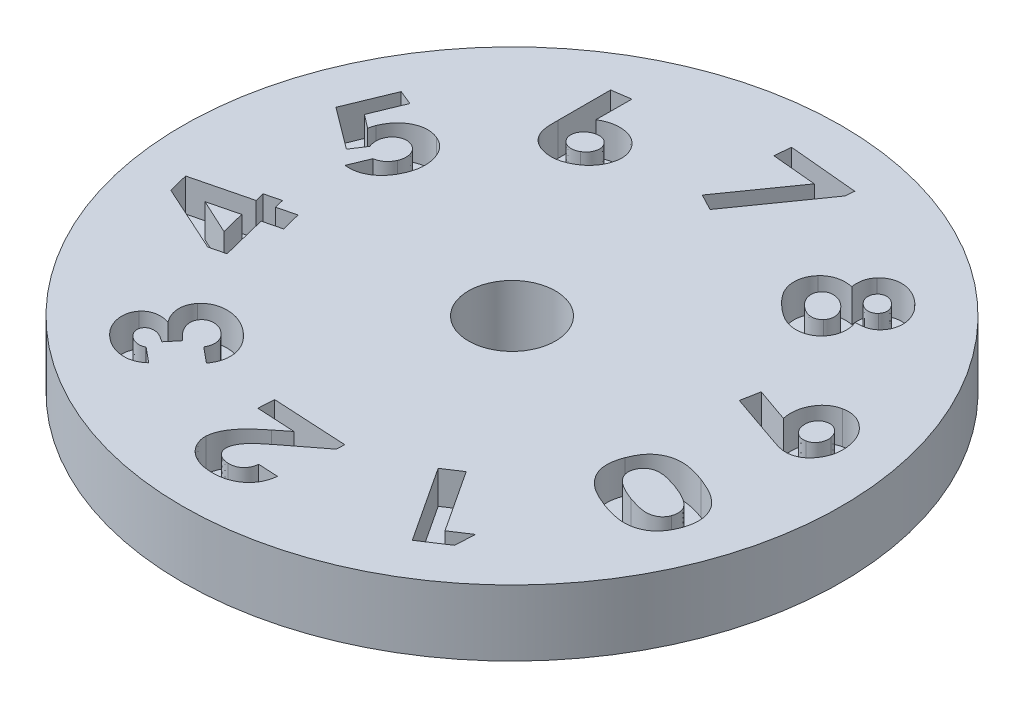
from build123d import *

# Parameters (mm, degrees)
SKETCH1_R           = 12.7
BOSS_EXTRUDE1_DEPTH = 2.54
SKETCH2_R           = 1.6764
CUT_EXTRUDE1_DEPTH  = 2.54
CUT_EXTRUDE4_DEPTH  = 1.27


with BuildPart() as part:
    # Sketch1 → Boss-Extrude1 (new body)
    with BuildSketch(Plane(origin=(0, 0, 0), x_dir=(1, 0, 0), z_dir=(0, 1, 0))):
        with Locations(Location((0, 0, 0), (0, 0, 270))):
            Circle(SKETCH1_R)
    extrude(amount=BOSS_EXTRUDE1_DEPTH)

    # Sketch2 → Cut-Extrude1 (cut)
    with BuildSketch(Plane(origin=(0, 2.54, 0), x_dir=(1, 0, 0), z_dir=(0, 1, 0))):
        with Locations(Location((0, 0, 0), (0, 0, 270))):
            Circle(SKETCH2_R)
    extrude(amount=-CUT_EXTRUDE1_DEPTH, mode=Mode.SUBTRACT)

    # Sketch5 → Cut-Extrude4 (cut)
    # profile 1 of 10: a face of its own
    with BuildSketch(Plane(origin=(0, 2.54, 0), x_dir=(1, 0, 0), z_dir=(0, 1, 0))):
        with BuildLine():
            Line((7.200060144, 1.559333116), (7.336077772, 2.269569494))
            Line((7.336077772, 2.269569494), (8.647175529, 1.812438084))
            add(Edge.make_bspline(
                [(8.647175529, 1.812438084), (8.63924741, 1.854633194), (8.623689486, 1.93743572), (8.61234446, 2.061800424), (8.612681851, 2.18329106), (8.622000967, 2.302327941), (8.643077891, 2.418630874), (8.67604615, 2.531894348), (8.717620294, 2.64309426), (8.770978871, 2.749678953), (8.832756124, 2.850001952), (8.902129014, 2.941727295), (8.979190441, 3.022872022), (9.062920587, 3.094484598), (9.154528822, 3.15476752), (9.253069034, 3.204955337), (9.358602518, 3.245362252), (9.432667942, 3.263606744), (9.470292516, 3.272874783)],
                knots=[0, 0, 0, 0, 1.103226358, 2.164941144, 3.204272597, 4.223051062, 5.230572354, 6.2365162, 7.25187019, 8.278202063, 9.295207627, 10.276891668, 11.228803511, 12.166504635, 13.102934718, 14.040635842, 15.004660519, 16, 16, 16, 16], degree=3))
            add(Edge.make_bspline(
                [(9.470292516, 3.272874783), (9.507108517, 3.279619098), (9.579863961, 3.292947152), (9.689816832, 3.29705253), (9.798110195, 3.290717296), (9.904363531, 3.269768836), (10.008688218, 3.237280496), (10.111309047, 3.193002811), (10.210927998, 3.134450598), (10.308359767, 3.065865754), (10.399944667, 2.987022324), (10.484694961, 2.901223717), (10.56073909, 2.80843361), (10.627487371, 2.708545344), (10.685083678, 2.601725427), (10.735098478, 2.488701105), (10.776189285, 2.368369775), (10.795444814, 2.284725044), (10.805228413, 2.242225744)],
                knots=[0, 0, 0, 0, 0.957561048, 1.892323361, 2.810142041, 3.730553296, 4.658293369, 5.604656248, 6.586221248, 7.612631226, 8.65277398, 9.677139646, 10.698071478, 11.720774225, 12.749346391, 13.802651807, 14.883542847, 16, 16, 16, 16], degree=3))
            add(Edge.make_bspline(
                [(10.805228413, 2.242225744), (10.813614481, 2.197459431), (10.830087402, 2.10952406), (10.842886879, 1.977964818), (10.843624307, 1.85007572), (10.833112473, 1.725690078), (10.811541582, 1.604955543), (10.778153812, 1.4876438), (10.734120999, 1.373858259), (10.678726656, 1.265298798), (10.615640247, 1.163692008), (10.54604331, 1.071579739), (10.471787309, 0.989427672), (10.391190976, 0.918828533), (10.30520165, 0.858688076), (10.213393602, 0.80949668), (10.116428834, 0.770084262), (10.048506, 0.75361125), (10.014363029, 0.745330712)],
                knots=[0, 0, 0, 0, 1.164219929, 2.286900642, 3.374552528, 4.43014487, 5.474581364, 6.505596207, 7.544341094, 8.589324539, 9.617425631, 10.598694511, 11.537747519, 12.443976869, 13.332556848, 14.214905489, 15.102681286, 16, 16, 16, 16], degree=3))
            add(Edge.make_bspline(
                [(10.014363029, 0.745330712), (9.987795573, 0.740293776), (9.934499048, 0.730189264), (9.852707561, 0.725808878), (9.769495311, 0.72486799), (9.69817641, 0.732081686), (9.637074362, 0.740795458), (9.584951825, 0.752915068), (9.526132525, 0.766529229), (9.460960553, 0.784302181), (9.389440463, 0.805361404), (9.311629811, 0.829990621), (9.227482861, 0.858031864), (9.169480853, 0.878455571), (9.139363029, 0.88906068)],
                knots=[0, 0, 0, 0, 1.081563666, 2.169706664, 3.27398775, 4.411013307, 5.035711453, 5.744229174, 6.552302137, 7.453522865, 8.448501374, 9.537690162, 10.721433689, 12, 12, 12, 12], degree=3))
            Line((9.139363029, 0.88906068), (7.200060144, 1.559333116))
        make_face()
        with BuildLine():
            add(Edge.make_bspline(
                [(9.271173926, 1.898676065), (9.279939874, 1.864566162), (9.296949092, 1.798380185), (9.343474894, 1.708248896), (9.403511967, 1.629686746), (9.477892566, 1.565765061), (9.560855674, 1.516912837), (9.650406755, 1.487190525), (9.744502067, 1.478394854), (9.806680848, 1.487887109), (9.838381458, 1.492726545)],
                knots=[0, 0, 0, 0, 1.0846268, 2.104581921, 3.107880126, 4.120866018, 5.113647809, 6.063090234, 7.012505227, 8, 8, 8, 8], degree=3))
            add(Edge.make_bspline(
                [(9.838381458, 1.492726545), (9.8545944, 1.496620694), (9.886561028, 1.504298683), (9.932378104, 1.521061291), (9.974759326, 1.543130709), (10.013975102, 1.56929426), (10.051058658, 1.598625044), (10.084170244, 1.633571974), (10.113991803, 1.672891839), (10.150332785, 1.729365119), (10.185167565, 1.805491995), (10.209125064, 1.901449297), (10.216741564, 2.000570013), (10.205763002, 2.065871528), (10.200160304, 2.099196898)],
                knots=[0, 0, 0, 0, 0.764898978, 1.508131071, 2.232548079, 2.952504152, 3.669497595, 4.397795506, 5.155136008, 5.931753396, 7.477302245, 8.970600964, 10.454004547, 12, 12, 12, 12], degree=3))
            add(Edge.make_bspline(
                [(10.200160304, 2.099196898), (10.191426775, 2.133554337), (10.174403385, 2.200523832), (10.126956565, 2.291816489), (10.066153212, 2.37265828), (10.002766502, 2.428742595), (9.947502011, 2.466964055), (9.904176261, 2.490297319), (9.859916957, 2.508897617), (9.81412236, 2.521299466), (9.767615745, 2.529108352), (9.720141059, 2.532014346), (9.671613874, 2.529351696), (9.639441805, 2.523059066), (9.623137067, 2.519869975)],
                knots=[0, 0, 0, 0, 1.600777341, 3.120234045, 4.623234054, 6.159700405, 6.928862642, 7.662924077, 8.384285194, 9.098153069, 9.806348983, 10.516756041, 11.248295052, 12, 12, 12, 12], degree=3))
            add(Edge.make_bspline(
                [(9.623137067, 2.519869975), (9.607144523, 2.516000168), (9.575611866, 2.508370033), (9.530566024, 2.491219329), (9.488284003, 2.470425265), (9.449389024, 2.444502718), (9.412778686, 2.41561724), (9.380201822, 2.380906693), (9.350241259, 2.342746101), (9.314766034, 2.286413776), (9.27985639, 2.209883867), (9.25757904, 2.110503592), (9.252730262, 2.005322929), (9.264889159, 1.935016494), (9.271173926, 1.898676065)],
                knots=[0, 0, 0, 0, 0.742715824, 1.46442005, 2.172714907, 2.866779619, 3.572551601, 4.27452227, 5.011663314, 5.76154953, 7.278543023, 8.784583619, 10.337995514, 12, 12, 12, 12], degree=3))
        make_face(mode=Mode.SUBTRACT)
    # profile 2 of 10: a face of its own
    with BuildSketch(Plane(origin=(0, 2.54, 0), x_dir=(1, 0, 0), z_dir=(0, 1, 0))):
        with BuildLine():
            add(Edge.make_bspline(
                [(6.836733634, 6.393054192), (6.852589151, 6.344055029), (6.883585644, 6.248264888), (6.91010717, 6.101985409), (6.915373901, 5.958140728), (6.903258056, 5.818032989), (6.872120996, 5.683676758), (6.824693655, 5.556906979), (6.758043015, 5.439468082), (6.701292365, 5.37006412), (6.672671134, 5.335061404)],
                knots=[0, 0, 0, 0, 1.097558351, 2.145654376, 3.158246499, 4.159129537, 5.136059096, 6.090452372, 7.036951916, 8, 8, 8, 8], degree=3))
            add(Edge.make_bspline(
                [(6.672671134, 5.335061404), (6.655914479, 5.316993236), (6.622598491, 5.281069666), (6.567315541, 5.232721049), (6.509382948, 5.188788014), (6.448584383, 5.148768307), (6.384079479, 5.114732388), (6.316284093, 5.085169715), (6.245588226, 5.059911796), (6.147514205, 5.032848693), (6.021597872, 5.012603388), (5.868071839, 5.009343768), (5.714175895, 5.030069809), (5.586004008, 5.063513388), (5.483835691, 5.102678111), (5.404702768, 5.137751008), (5.32499777, 5.179957743), (5.244141799, 5.228927026), (5.161263894, 5.283154657), (5.078320326, 5.345527833), (4.992865955, 5.412375613), (4.937605783, 5.461423997), (4.90934982, 5.486503712)],
                knots=[0, 0, 0, 0, 0.744075126, 1.479388193, 2.21514184, 2.939766201, 3.675756976, 4.415632525, 5.172726466, 5.941874045, 7.486911853, 9.012318769, 10.564230564, 12.163869566, 13.00185396, 13.867896385, 14.777514746, 15.724459843, 16.723215713, 17.768246618, 18.858846435, 20, 20, 20, 20], degree=3))
            add(Edge.make_bspline(
                [(4.90934982, 5.486503712), (4.87944894, 5.513613612), (4.821263739, 5.566367745), (4.739902586, 5.64732756), (4.665433506, 5.726508561), (4.59794376, 5.804117658), (4.537994545, 5.880856135), (4.485518671, 5.956205252), (4.440289594, 6.03017632), (4.40197127, 6.10295066), (4.37013835, 6.1756161), (4.344543782, 6.248653904), (4.322685019, 6.321668787), (4.30878753, 6.395784716), (4.297354739, 6.470065708), (4.293814288, 6.545156701), (4.294190142, 6.620572217), (4.300526264, 6.696053262), (4.312528847, 6.770742996), (4.329192674, 6.843956979), (4.351547976, 6.91484644), (4.380076144, 6.983367457), (4.413352729, 7.049988429), (4.453421106, 7.113843398), (4.496940553, 7.176680914), (4.530606823, 7.215527167), (4.547570974, 7.235101468)],
                knots=[0, 0, 0, 0, 1.442282224, 2.806589035, 4.100671198, 5.32642599, 6.480931161, 7.579167812, 8.60624067, 9.577599366, 10.516417419, 11.438402222, 12.342469347, 13.236838815, 14.131013256, 15.026123434, 15.919868669, 16.825053998, 17.729969542, 18.621448269, 19.506368595, 20.382733407, 21.27174369, 22.164200065, 23.074955818, 24, 24, 24, 24], degree=3))
            add(Edge.make_bspline(
                [(4.547570974, 7.235101468), (4.578530611, 7.26707754), (4.639730093, 7.330286261), (4.745161224, 7.408751563), (4.860431287, 7.469372993), (4.984381419, 7.514839498), (5.117730474, 7.543181274), (5.260111421, 7.555629192), (5.4113769, 7.551291898), (5.514065933, 7.536035198), (5.567002064, 7.528170378)],
                knots=[0, 0, 0, 0, 0.960178668, 1.898033756, 2.823830733, 3.764385042, 4.740576892, 5.759211228, 6.844874818, 8, 8, 8, 8], degree=3))
            add(Edge.make_bspline(
                [(5.567002064, 7.528170378), (5.562599908, 7.567147823), (5.553999015, 7.643301609), (5.552521829, 7.755532896), (5.561604295, 7.862139714), (5.580367282, 7.963040954), (5.609432803, 8.058519455), (5.651186507, 8.146971105), (5.700235095, 8.23130045), (5.742200834, 8.280805609), (5.763316166, 8.305714449)],
                knots=[0, 0, 0, 0, 1.135338592, 2.218214479, 3.243878854, 4.228722406, 5.185520514, 6.124221573, 7.056189995, 8, 8, 8, 8], degree=3))
            add(Edge.make_bspline(
                [(5.763316166, 8.305714449), (5.77845494, 8.322127989), (5.80841957, 8.354615803), (5.857967807, 8.397891139), (5.909533869, 8.43737583), (5.963063195, 8.473588888), (6.020678215, 8.503409528), (6.080033669, 8.530130365), (6.142001417, 8.55290231), (6.228221108, 8.575830689), (6.340134048, 8.594891828), (6.478320022, 8.595353542), (6.619859511, 8.577759946), (6.762968788, 8.539065313), (6.907318797, 8.482869116), (7.049935189, 8.407186558), (7.190307981, 8.31270605), (7.278198633, 8.238126242), (7.32331216, 8.199845058)],
                knots=[0, 0, 0, 0, 0.613378461, 1.214078443, 1.805117288, 2.398420992, 2.987536618, 3.585654856, 4.187178655, 4.799614493, 6.036305238, 7.295466124, 8.583881707, 9.945714883, 11.35935011, 12.833476511, 14.374650316, 16, 16, 16, 16], degree=3))
            add(Edge.make_bspline(
                [(7.32331216, 8.199845058), (7.36563466, 8.159665253), (7.448011359, 8.081459107), (7.556637039, 7.954944514), (7.644296349, 7.822154897), (7.715100668, 7.686844106), (7.767025431, 7.549216747), (7.797998946, 7.410188797), (7.810756243, 7.270975679), (7.801493995, 7.133513389), (7.776543565, 7.000550222), (7.731677337, 6.876527316), (7.670903673, 6.760953403), (7.61597847, 6.694384786), (7.588336198, 6.660882718)],
                knots=[0, 0, 0, 0, 1.206827046, 2.348973416, 3.440470803, 4.491381843, 5.502574376, 6.473759846, 7.429735682, 8.383937191, 9.315040909, 10.218819742, 11.103583282, 12, 12, 12, 12], degree=3))
            add(Edge.make_bspline(
                [(7.588336198, 6.660882718), (7.567340064, 6.638847804), (7.525778259, 6.595229736), (7.455034172, 6.539610572), (7.378743025, 6.49393011), (7.295950201, 6.45627238), (7.202260195, 6.42769595), (7.094114359, 6.409550365), (6.970765677, 6.3955733), (6.88305548, 6.393924803), (6.836733634, 6.393054192)],
                knots=[0, 0, 0, 0, 0.884701208, 1.751264281, 2.608385166, 3.466584259, 4.391452059, 5.449093984, 6.652805745, 8, 8, 8, 8], degree=3))
        make_face()
        with BuildLine():
            add(Edge.make_bspline(
                [(6.881605429, 7.743414769), (6.857883547, 7.762916185), (6.812157519, 7.80050689), (6.735692335, 7.842404226), (6.655975184, 7.866934503), (6.575449804, 7.877189944), (6.496432482, 7.871341016), (6.42269096, 7.848148975), (6.354336265, 7.809976378), (6.317767681, 7.772494385), (6.298973217, 7.753230474)],
                knots=[0, 0, 0, 0, 1.129460008, 2.177134192, 3.187214561, 4.184448773, 5.151657985, 6.080091041, 7.013260728, 8, 8, 8, 8], degree=3))
            add(Edge.make_bspline(
                [(6.298973217, 7.753230474), (6.282229734, 7.732177088), (6.24945104, 7.6909609), (6.219032842, 7.617470953), (6.204748304, 7.538843046), (6.208159567, 7.456289241), (6.227107742, 7.373850233), (6.261215469, 7.2947785), (6.311267667, 7.221042286), (6.354482735, 7.178991004), (6.376797737, 7.157276949)],
                knots=[0, 0, 0, 0, 0.961435784, 1.882201577, 2.820002509, 3.810348711, 4.825706088, 5.840092891, 6.88468695, 8, 8, 8, 8], degree=3))
            add(Edge.make_bspline(
                [(6.376797737, 7.157276949), (6.401210352, 7.137288451), (6.448472964, 7.098590892), (6.527321755, 7.055577199), (6.609366406, 7.030111086), (6.692091198, 7.019911517), (6.773665228, 7.026325939), (6.849650465, 7.051817439), (6.920500516, 7.092327014), (6.958648943, 7.131452061), (6.978360237, 7.151667974)],
                knots=[0, 0, 0, 0, 1.122084775, 2.172346473, 3.175368844, 4.164444937, 5.125273633, 6.062337535, 6.998809762, 8, 8, 8, 8], degree=3))
            add(Edge.make_bspline(
                [(6.978360237, 7.151667974), (6.995072942, 7.172488861), (7.027770272, 7.213223582), (7.058303515, 7.285209683), (7.071064778, 7.3617621), (7.066451181, 7.441386394), (7.044899925, 7.521798874), (7.00712251, 7.600603709), (6.951935845, 7.675871227), (6.905714303, 7.720261221), (6.881605429, 7.743414769)],
                knots=[0, 0, 0, 0, 0.950323572, 1.85924673, 2.757017034, 3.701895845, 4.686204314, 5.713287886, 6.807264965, 8, 8, 8, 8], degree=3))
        make_face(mode=Mode.SUBTRACT)
        with BuildLine():
            add(Edge.make_bspline(
                [(5.979962801, 6.688226468), (5.962395363, 6.70319334), (5.927884491, 6.732595453), (5.873662927, 6.771808344), (5.81908465, 6.806418898), (5.763358734, 6.835511125), (5.706211036, 6.858664575), (5.648236112, 6.876687451), (5.589501536, 6.890555885), (5.530504484, 6.897768616), (5.472598887, 6.900924198), (5.417343015, 6.898328332), (5.365422257, 6.889751408), (5.316830577, 6.876293517), (5.270746456, 6.858697849), (5.229240279, 6.833170636), (5.19017974, 6.804071029), (5.167533335, 6.780639133), (5.156144692, 6.768855474)],
                knots=[0, 0, 0, 0, 1.2094805, 2.375999597, 3.504583554, 4.595082795, 5.666697505, 6.73234217, 7.775564687, 8.825671342, 9.843769825, 10.812919884, 11.719321504, 12.596176409, 13.453905817, 14.294398448, 15.142270593, 16, 16, 16, 16], degree=3))
            add(Edge.make_bspline(
                [(5.156144692, 6.768855474), (5.144966242, 6.755844279), (5.122899605, 6.73015974), (5.097600467, 6.686705015), (5.0757679, 6.642251169), (5.060408404, 6.594797743), (5.050706681, 6.545125131), (5.046478684, 6.493155304), (5.048046086, 6.439116938), (5.055123086, 6.38325327), (5.067538272, 6.326832997), (5.086094518, 6.271038982), (5.109907519, 6.21592545), (5.140373286, 6.162339693), (5.17552243, 6.109005663), (5.217355241, 6.057646812), (5.26332638, 6.00574733), (5.298162399, 5.973943145), (5.316000461, 5.957657558)],
                knots=[0, 0, 0, 0, 0.891856109, 1.760554105, 2.610184059, 3.468839958, 4.349992737, 5.241848846, 6.179728474, 7.161400932, 8.171727796, 9.184399829, 10.220446241, 11.294296924, 12.391840099, 13.544208166, 14.742492112, 16, 16, 16, 16], degree=3))
            add(Edge.make_bspline(
                [(5.316000461, 5.957657558), (5.334228839, 5.941706336), (5.369949585, 5.910447957), (5.426170395, 5.869645878), (5.481507614, 5.832929116), (5.537940525, 5.804137357), (5.593199808, 5.778720151), (5.649348613, 5.760783822), (5.705014734, 5.747002565), (5.760543013, 5.740232119), (5.81458305, 5.738551626), (5.866678706, 5.743062893), (5.916811512, 5.751539555), (5.963877786, 5.767524063), (6.008616077, 5.787694331), (6.050303982, 5.814209713), (6.08997059, 5.845820135), (6.113686628, 5.870656896), (6.125796134, 5.883338648)],
                knots=[0, 0, 0, 0, 1.276310836, 2.5010879, 3.659683435, 4.772972885, 5.837607513, 6.862351747, 7.875474487, 8.856624631, 9.805684849, 10.720453346, 11.609808972, 12.478701025, 13.333234605, 14.191313982, 15.076477538, 16, 16, 16, 16], degree=3))
            add(Edge.make_bspline(
                [(6.125796134, 5.883338648), (6.137062048, 5.896908871), (6.159141277, 5.923504143), (6.187095101, 5.966715316), (6.207998367, 6.012685089), (6.223584623, 6.06066642), (6.233413542, 6.110809633), (6.237485966, 6.16323842), (6.236277361, 6.217814809), (6.227959427, 6.273784175), (6.215886906, 6.330280195), (6.197287706, 6.385761364), (6.174015384, 6.440248916), (6.145580545, 6.493185554), (6.111153782, 6.544108469), (6.072650202, 6.593872824), (6.029110425, 6.642688168), (5.996581668, 6.672828064), (5.979962801, 6.688226468)],
                knots=[0, 0, 0, 0, 0.929426314, 1.821513578, 2.703589091, 3.584200434, 4.475862145, 5.390635351, 6.352017719, 7.347001339, 8.36937771, 9.394127218, 10.426331159, 11.490329382, 12.556536921, 13.663129975, 14.806098493, 16, 16, 16, 16], degree=3))
        make_face(mode=Mode.SUBTRACT)
    # profile 3 of 10: a face of its own
    with BuildSketch(Plane(origin=(0, 2.54, 0), x_dir=(1, 0, 0), z_dir=(0, 1, 0))):
        Polygon((-0.242424866, 11.015336488), (2.442871608, 10.765737129), (2.410620006, 10.417980719), (0.264486192, 7.368802033), (-0.370029033, 7.701834885), (1.414325935, 10.233585686), (-0.299916853, 10.392740334), align=None)
    # profile 4 of 10: a face of its own
    with BuildSketch(Plane(origin=(0, 2.54, 0), x_dir=(1, 0, 0), z_dir=(0, 1, 0))):
        with BuildLine():
            Line((-5.640517998, 9.442175742), (-4.92677601, 9.544539524))
            Line((-4.92677601, 9.544539524), (-4.932384985, 8.167536319))
            add(Edge.make_bspline(
                [(-4.932384985, 8.167536319), (-4.895306771, 8.188699048), (-4.822333475, 8.230349224), (-4.708878937, 8.281750208), (-4.59458506, 8.32174061), (-4.479419978, 8.351015633), (-4.363153516, 8.368322107), (-4.24605456, 8.375652913), (-4.128018181, 8.371036222), (-4.010435785, 8.356580517), (-3.895837675, 8.331699933), (-3.786982528, 8.296959414), (-3.685997646, 8.250604166), (-3.591657233, 8.195698997), (-3.505436625, 8.129291663), (-3.42567966, 8.054183306), (-3.353614674, 7.968264098), (-3.313039071, 7.904634081), (-3.292461107, 7.872364043)],
                knots=[0, 0, 0, 0, 1.103827491, 2.1724329, 3.216267318, 4.232285743, 5.241085472, 6.25239954, 7.262556704, 8.292009249, 9.312889333, 10.291647889, 11.241185426, 12.181499897, 13.108822839, 14.04954526, 15.010824579, 16, 16, 16, 16], degree=3))
            add(Edge.make_bspline(
                [(-3.292461107, 7.872364043), (-3.274144582, 7.840037557), (-3.238074583, 7.776378302), (-3.198181943, 7.675187567), (-3.170513289, 7.571895573), (-3.15514145, 7.466244597), (-3.151522162, 7.358049534), (-3.160883265, 7.247509293), (-3.18310403, 7.134863921), (-3.216790384, 7.021407099), (-3.260373178, 6.909625537), (-3.313879361, 6.802221958), (-3.377210945, 6.701329562), (-3.44938739, 6.605797525), (-3.53045344, 6.51600547), (-3.621858043, 6.433176681), (-3.721503587, 6.355440589), (-3.793592083, 6.309678878), (-3.830221523, 6.286426543)],
                knots=[0, 0, 0, 0, 0.957639256, 1.885840617, 2.797024185, 3.711135658, 4.634152374, 5.58403456, 6.566706521, 7.591254518, 8.633690301, 9.658362487, 10.682253808, 11.702463494, 12.744027019, 13.798167651, 14.881210047, 16, 16, 16, 16], degree=3))
            add(Edge.make_bspline(
                [(-3.830221523, 6.286426543), (-3.869587592, 6.263755433), (-3.94677306, 6.219303947), (-4.066751109, 6.165719938), (-4.186147394, 6.121805635), (-4.306920859, 6.092300148), (-4.427549698, 6.071702082), (-4.548823296, 6.065252377), (-4.670185014, 6.069186968), (-4.790366635, 6.085317028), (-4.906237198, 6.112055346), (-5.015757188, 6.145821786), (-5.116465557, 6.189576219), (-5.208955805, 6.241543491), (-5.293299039, 6.30233408), (-5.3689217, 6.371841174), (-5.436873743, 6.449715224), (-5.47432673, 6.507487396), (-5.493282421, 6.536727024)],
                knots=[0, 0, 0, 0, 1.169006437, 2.292083284, 3.378978322, 4.440061262, 5.488751117, 6.525563516, 7.561257607, 8.611500284, 9.642164534, 10.620425414, 11.558375108, 12.463791612, 13.347345682, 14.22901234, 15.103668441, 16, 16, 16, 16], degree=3))
            add(Edge.make_bspline(
                [(-5.493282421, 6.536727024), (-5.506649621, 6.559838506), (-5.533658302, 6.606535692), (-5.564923443, 6.681782356), (-5.592254195, 6.760229799), (-5.609384425, 6.829518425), (-5.619407634, 6.890431351), (-5.626435504, 6.943254713), (-5.631747522, 7.003394115), (-5.636784924, 7.070222989), (-5.640167554, 7.144337438), (-5.642233241, 7.225216101), (-5.64273168, 7.313335783), (-5.642659154, 7.374334017), (-5.642621363, 7.40611805)],
                knots=[0, 0, 0, 0, 1.073461379, 2.168948956, 3.272482822, 4.415398746, 5.035471171, 5.756476462, 6.559506023, 7.46486387, 8.453596113, 9.545038301, 10.720805845, 12, 12, 12, 12], degree=3))
            Line((-5.642621363, 7.40611805), (-5.640517998, 9.442175742))
        make_face()
        with BuildLine():
            add(Edge.make_bspline(
                [(-4.648430658, 7.60944337), (-4.677795924, 7.590184605), (-4.734740548, 7.552838333), (-4.804511336, 7.479915559), (-4.85904455, 7.398223562), (-4.895706608, 7.308036825), (-4.915356356, 7.214511691), (-4.914007846, 7.120923449), (-4.892025955, 7.029466462), (-4.862615908, 6.973931427), (-4.847549248, 6.94548103)],
                knots=[0, 0, 0, 0, 1.08716105, 2.108204256, 3.108307706, 4.120158552, 5.111910923, 6.055214407, 7.003693424, 8, 8, 8, 8], degree=3))
            add(Edge.make_bspline(
                [(-4.847549248, 6.94548103), (-4.838762932, 6.931685272), (-4.821413467, 6.904444158), (-4.789909977, 6.868129611), (-4.756664679, 6.834882881), (-4.719595551, 6.806510481), (-4.679521455, 6.782667416), (-4.63616689, 6.763024338), (-4.590088129, 6.746655898), (-4.524879105, 6.73222814), (-4.44209046, 6.724505753), (-4.343706883, 6.732802831), (-4.248161687, 6.759559846), (-4.190076779, 6.791214307), (-4.160449889, 6.807360037)],
                knots=[0, 0, 0, 0, 0.755313398, 1.491442344, 2.217427216, 2.926402404, 3.643647951, 4.368989078, 5.124302476, 5.900283961, 7.452021163, 8.948979659, 10.443791194, 12, 12, 12, 12], degree=3))
            add(Edge.make_bspline(
                [(-4.160449889, 6.807360037), (-4.131094175, 6.826628781), (-4.07361402, 6.864358078), (-4.002936186, 6.938269358), (-3.947075975, 7.021786869), (-3.907565924, 7.113680831), (-3.884869148, 7.209735748), (-3.88495945, 7.306045212), (-3.906037118, 7.400149881), (-3.936098405, 7.4569272), (-3.951515594, 7.486045934)],
                knots=[0, 0, 0, 0, 1.063552704, 2.082496636, 3.080559992, 4.101084832, 5.104986338, 6.056087312, 7.003047735, 8, 8, 8, 8], degree=3))
            add(Edge.make_bspline(
                [(-3.951515594, 7.486045934), (-3.960363716, 7.49978616), (-3.977753997, 7.526791483), (-4.008143146, 7.56368171), (-4.041965271, 7.595605704), (-4.077770559, 7.624492585), (-4.117840981, 7.647390221), (-4.160123422, 7.66720888), (-4.205951677, 7.681778601), (-4.269850353, 7.696788205), (-4.353216185, 7.704005214), (-4.453732186, 7.692071906), (-4.554089297, 7.661711846), (-4.616265003, 7.627264289), (-4.648430658, 7.60944337)],
                knots=[0, 0, 0, 0, 0.744322381, 1.462906506, 2.170917381, 2.861165346, 3.55338217, 4.268168423, 4.985488825, 5.739800526, 7.257418184, 8.768632917, 10.328301479, 12, 12, 12, 12], degree=3))
        make_face(mode=Mode.SUBTRACT)
    # profile 5 of 10: a face of its own
    with BuildSketch(Plane(origin=(0, 2.54, 0), x_dir=(1, 0, 0), z_dir=(0, 1, 0))):
        with BuildLine():
            Line((-10.356241242, 3.572107795), (-9.622166723, 5.353658275))
            Line((-9.622166723, 5.353658275), (-9.057062556, 5.120885839))
            Line((-9.057062556, 5.120885839), (-9.568180344, 3.879900262))
            Line((-9.568180344, 3.879900262), (-9.044442364, 3.482364205))
            add(Edge.make_bspline(
                [(-9.044442364, 3.482364205), (-9.04051094, 3.505555411), (-9.032760558, 3.551274399), (-9.016592531, 3.617784939), (-8.997057531, 3.680665469), (-8.98177522, 3.720816684), (-8.974330184, 3.740377025)],
                knots=[0, 0, 0, 0, 1.05320264, 2.076276626, 3.062825712, 4, 4, 4, 4], degree=3))
            add(Edge.make_bspline(
                [(-8.974330184, 3.740377025), (-8.956081314, 3.782302005), (-8.920330832, 3.864435213), (-8.855999161, 3.980110183), (-8.784253662, 4.086025089), (-8.706345461, 4.183742128), (-8.620624622, 4.271299953), (-8.52812486, 4.350018208), (-8.428099725, 4.418716135), (-8.322154126, 4.478184629), (-8.212184549, 4.526192589), (-8.100484311, 4.562574964), (-7.987661763, 4.586027802), (-7.873742744, 4.595953867), (-7.759259156, 4.591952678), (-7.644066295, 4.576559232), (-7.527755674, 4.547961696), (-7.452146175, 4.518768671), (-7.413633069, 4.50389866)],
                knots=[0, 0, 0, 0, 1.128388696, 2.210571911, 3.261984412, 4.283850626, 5.291676214, 6.282393784, 7.277905149, 8.282753305, 9.277545401, 10.235512056, 11.178133999, 12.116348453, 13.051524048, 14.000552232, 14.981544069, 16, 16, 16, 16], degree=3))
            add(Edge.make_bspline(
                [(-7.413633069, 4.50389866), (-7.375570791, 4.486996953), (-7.300365144, 4.453601586), (-7.196331828, 4.38909728), (-7.102001642, 4.314873274), (-7.015724891, 4.232095446), (-6.941969823, 4.136794828), (-6.875314066, 4.033558586), (-6.819040914, 3.919678921), (-6.773824216, 3.797259259), (-6.737786168, 3.669835196), (-6.714833205, 3.539683642), (-6.703528421, 3.408761787), (-6.704059842, 3.276828368), (-6.717779333, 3.144052194), (-6.743059608, 3.010298713), (-6.781075513, 2.875685631), (-6.815093049, 2.78753616), (-6.832403101, 2.742680711)],
                knots=[0, 0, 0, 0, 0.967864756, 1.912363067, 2.837832927, 3.756636573, 4.685469325, 5.634026656, 6.61137187, 7.633227887, 8.665987002, 9.687582692, 10.702473802, 11.719081542, 12.751726186, 13.803005627, 14.882044702, 16, 16, 16, 16], degree=3))
            add(Edge.make_bspline(
                [(-6.832403101, 2.742680711), (-6.849431804, 2.703188344), (-6.882979509, 2.625385689), (-6.941173854, 2.514310041), (-7.006129737, 2.411245646), (-7.075262603, 2.314677399), (-7.150740446, 2.226007433), (-7.231569581, 2.144409489), (-7.317862769, 2.069798279), (-7.409678186, 2.003367698), (-7.505236485, 1.945187816), (-7.603930385, 1.896800311), (-7.704247396, 1.856836564), (-7.807558351, 1.828411063), (-7.912790332, 1.808166042), (-8.020616052, 1.799760971), (-8.130675365, 1.799040909), (-8.204306258, 1.806902035), (-8.241657908, 1.810889846)],
                knots=[0, 0, 0, 0, 1.131331782, 2.228800719, 3.295164642, 4.33453945, 5.351015502, 6.355441899, 7.35390255, 8.348968002, 9.333950393, 10.29371476, 11.238069157, 12.170577355, 13.108886311, 14.053100555, 15.012372327, 16, 16, 16, 16], degree=3))
            Line((-8.241657908, 1.810889846), (-7.928256466, 2.570905871))
            add(Edge.make_bspline(
                [(-7.928256466, 2.570905871), (-7.897932693, 2.576467799), (-7.838431971, 2.587381304), (-7.753227442, 2.616372066), (-7.674992483, 2.656887733), (-7.602856797, 2.706841321), (-7.538508644, 2.766590521), (-7.482006968, 2.834459237), (-7.433685351, 2.910135788), (-7.408769236, 2.965063081), (-7.396105024, 2.992981192)],
                knots=[0, 0, 0, 0, 1.038055795, 2.036852991, 3.01965287, 3.998499714, 4.985048166, 5.969298767, 6.96784749, 8, 8, 8, 8], degree=3))
            add(Edge.make_bspline(
                [(-7.396105024, 2.992981192), (-7.388189601, 3.012698956), (-7.37259992, 3.051533727), (-7.35701304, 3.111689873), (-7.345430993, 3.17112835), (-7.339809371, 3.230298573), (-7.339783753, 3.288987551), (-7.345387814, 3.347222219), (-7.356749297, 3.405196338), (-7.373581234, 3.462148224), (-7.394681033, 3.517178803), (-7.421854308, 3.56824871), (-7.453161963, 3.615148702), (-7.489550284, 3.658054042), (-7.530964712, 3.696324842), (-7.576581907, 3.730915075), (-7.627253664, 3.760842475), (-7.663521871, 3.776963212), (-7.682162716, 3.78524882)],
                knots=[0, 0, 0, 0, 1.082329004, 2.131681847, 3.162396553, 4.16793491, 5.157027019, 6.150702926, 7.146306292, 8.164475773, 9.175787873, 10.145962461, 11.107757477, 12.046160743, 13.007364975, 13.977393177, 14.960436618, 16, 16, 16, 16], degree=3))
            add(Edge.make_bspline(
                [(-7.682162716, 3.78524882), (-7.700484771, 3.792457277), (-7.736549251, 3.806646145), (-7.792212195, 3.820199431), (-7.847073248, 3.82912448), (-7.901661892, 3.83101389), (-7.955683067, 3.827526934), (-8.009380533, 3.818536969), (-8.062450291, 3.802740218), (-8.11435886, 3.781307113), (-8.163973273, 3.754351821), (-8.210931703, 3.724556509), (-8.254207212, 3.690793821), (-8.292944222, 3.652244791), (-8.328874232, 3.610225417), (-8.361029892, 3.563962001), (-8.389277501, 3.51387405), (-8.404845104, 3.478533099), (-8.412731626, 3.460629429)],
                knots=[0, 0, 0, 0, 1.05655302, 2.079681266, 3.070485004, 4.037945924, 5.006709384, 5.974740381, 6.956032694, 7.974915416, 8.985955385, 9.985470698, 10.959993174, 11.927698454, 12.916352163, 13.926378245, 14.949506491, 16, 16, 16, 16], degree=3))
            add(Edge.make_bspline(
                [(-8.412731626, 3.460629429), (-8.420203486, 3.440674791), (-8.435256732, 3.400473005), (-8.449476047, 3.337301424), (-8.458044136, 3.272066846), (-8.46022625, 3.204875153), (-8.45496117, 3.13565421), (-8.443533603, 3.064658148), (-8.426238898, 2.991343326), (-8.409431326, 2.94283552), (-8.400812556, 2.91796116)],
                knots=[0, 0, 0, 0, 0.919586647, 1.852653252, 2.789372435, 3.759081538, 4.751030752, 5.783463661, 6.863380412, 8, 8, 8, 8], degree=3))
            Line((-8.400812556, 2.91796116), (-8.756281306, 2.374591769))
            Line((-8.756281306, 2.374591769), (-10.356241242, 3.572107795))
        make_face()
    # profile 6 of 10: a face of its own
    with BuildSketch(Plane(origin=(0, 2.54, 0), x_dir=(1, 0, 0), z_dir=(0, 1, 0))):
        Polygon((-10.769758447, -2.378931931), (-10.959762454, -1.618214783), (-8.781377037, -1.074845392), (-8.869718383, -0.71867552), (-8.273764857, -0.5700377), (-8.185423511, -0.926207572), (-7.490611813, -0.753030488), (-7.304814537, -1.496920713), (-7.999626236, -1.670097796), (-7.564930723, -3.414488822), (-8.160884248, -3.563126642), align=None)
        Polygon((-8.595579761, -1.818735616), (-9.729293704, -2.1012877), (-8.367715178, -2.731596193), align=None, mode=Mode.SUBTRACT)
    # profile 7 of 10: a face of its own
    with BuildSketch(Plane(origin=(0, 2.54, 0), x_dir=(1, 0, 0), z_dir=(0, 1, 0))):
        with BuildLine():
            Line((-6.013305305, -8.08735243), (-5.436282068, -8.564816373))
            add(Edge.make_bspline(
                [(-5.436282068, -8.564816373), (-5.460527714, -8.585511451), (-5.508109388, -8.626125196), (-5.583489959, -8.679990321), (-5.661510205, -8.724675577), (-5.741452958, -8.762250694), (-5.823192032, -8.792536325), (-5.907248841, -8.81446748), (-5.993276232, -8.827807846), (-6.051356555, -8.831024562), (-6.080612998, -8.832644898)],
                knots=[0, 0, 0, 0, 1.072683846, 2.105124132, 3.113058437, 4.094899467, 5.075479139, 6.04284319, 7.014133467, 8, 8, 8, 8], degree=3))
            add(Edge.make_bspline(
                [(-6.080612998, -8.832644898), (-6.121547471, -8.832488726), (-6.203207479, -8.832177179), (-6.324914109, -8.817782514), (-6.444551158, -8.791610524), (-6.56244701, -8.754239077), (-6.678404467, -8.704936966), (-6.792315929, -8.643501179), (-6.904264016, -8.57030071), (-6.975423752, -8.514194129), (-7.011702741, -8.48558961)],
                knots=[0, 0, 0, 0, 0.966366457, 1.927800344, 2.888282756, 3.855547639, 4.845038866, 5.860193571, 6.909073885, 8, 8, 8, 8], degree=3))
            add(Edge.make_bspline(
                [(-7.011702741, -8.48558961), (-7.043035633, -8.458763052), (-7.104518439, -8.406122777), (-7.187007694, -8.319623888), (-7.262020892, -8.231620146), (-7.326917621, -8.139432698), (-7.381403674, -8.043491045), (-7.428451348, -7.945218667), (-7.46480213, -7.842900662), (-7.491857747, -7.738712075), (-7.50958962, -7.635024677), (-7.516608087, -7.534277419), (-7.514302911, -7.437885793), (-7.500885901, -7.345605214), (-7.476985592, -7.25783778), (-7.443254248, -7.174297622), (-7.39856384, -7.095548607), (-7.361903347, -7.047425707), (-7.34333335, -7.023049546)],
                knots=[0, 0, 0, 0, 1.190865739, 2.3367702, 3.448431877, 4.529178266, 5.587658605, 6.632617022, 7.672612795, 8.718987899, 9.739003379, 10.70680691, 11.632138642, 12.519141119, 13.393723603, 14.253774901, 15.11546757, 16, 16, 16, 16], degree=3))
            add(Edge.make_bspline(
                [(-7.34333335, -7.023049546), (-7.317888581, -6.994892654), (-7.267456751, -6.939085364), (-7.174752083, -6.873871163), (-7.072355535, -6.822854733), (-6.958597412, -6.790020019), (-6.835888831, -6.772048723), (-6.70519437, -6.773876673), (-6.567284205, -6.791809547), (-6.475315861, -6.817587144), (-6.427668286, -6.830942174)],
                knots=[0, 0, 0, 0, 0.913289578, 1.810150638, 2.71560578, 3.663080712, 4.654453561, 5.697800693, 6.807261198, 8, 8, 8, 8], degree=3))
            add(Edge.make_bspline(
                [(-6.427668286, -6.830942174), (-6.44574595, -6.805209554), (-6.48124661, -6.754676199), (-6.528296524, -6.676446179), (-6.569120292, -6.598464021), (-6.602300509, -6.519791201), (-6.628936491, -6.44127612), (-6.649580488, -6.362624092), (-6.66294861, -6.283795456), (-6.669323748, -6.205202041), (-6.668580379, -6.12777451), (-6.661389634, -6.052071162), (-6.648800528, -5.978285306), (-6.626620858, -5.907216543), (-6.600896704, -5.837294296), (-6.565625142, -5.770723865), (-6.525189934, -5.705745301), (-6.493488819, -5.665173556), (-6.477447933, -5.644644097)],
                knots=[0, 0, 0, 0, 1.173354189, 2.3042164, 3.404320102, 4.455697514, 5.487279256, 6.496381154, 7.48722414, 8.46725901, 9.43546204, 10.372803929, 11.303507596, 12.222489345, 13.147412314, 14.079749369, 15.028345814, 16, 16, 16, 16], degree=3))
            add(Edge.make_bspline(
                [(-6.477447933, -5.644644097), (-6.452189167, -5.615924571), (-6.402158898, -5.559039546), (-6.315890647, -5.486322718), (-6.223245748, -5.424626503), (-6.123774925, -5.374372772), (-6.017153012, -5.336787567), (-5.903934453, -5.309690723), (-5.78374312, -5.29564198), (-5.657961724, -5.292100808), (-5.529343686, -5.30056198), (-5.400382489, -5.320756217), (-5.272549492, -5.354274825), (-5.145852462, -5.399802039), (-5.020397277, -5.458014433), (-4.89597917, -5.527536723), (-4.772899847, -5.609933723), (-4.694076469, -5.672363508), (-4.653830145, -5.70423945)],
                knots=[0, 0, 0, 0, 0.903444085, 1.789459926, 2.658594414, 3.531096293, 4.417405126, 5.326293166, 6.278478538, 7.273688965, 8.298298453, 9.322326442, 10.355855618, 11.418758557, 12.501901493, 13.622769001, 14.78621278, 16, 16, 16, 16], degree=3))
            add(Edge.make_bspline(
                [(-4.653830145, -5.70423945), (-4.616919069, -5.735991893), (-4.544919393, -5.797929011), (-4.446557858, -5.897472713), (-4.360600423, -6.000586984), (-4.284609593, -6.106092244), (-4.22101765, -6.214977821), (-4.167303052, -6.326444218), (-4.127117197, -6.441631231), (-4.097402298, -6.558664583), (-4.079684938, -6.676564165), (-4.074678913, -6.79385923), (-4.082415626, -6.909771083), (-4.102861993, -7.024053836), (-4.136327951, -7.136670699), (-4.181347161, -7.248213636), (-4.239795785, -7.35811365), (-4.287392438, -7.427793777), (-4.311682709, -7.463354033)],
                knots=[0, 0, 0, 0, 1.170503401, 2.28321347, 3.36038697, 4.395866217, 5.405978147, 6.388880886, 7.366483531, 8.334231402, 9.288769546, 10.228115486, 11.151848504, 12.076743279, 13.013918056, 13.971940561, 14.965008885, 16, 16, 16, 16], degree=3))
            Line((-4.311682709, -7.463354033), (-4.906233991, -6.971867655))
            add(Edge.make_bspline(
                [(-4.906233991, -6.971867655), (-4.895905151, -6.95214048), (-4.875809121, -6.913758833), (-4.851003601, -6.85520245), (-4.832277538, -6.797411907), (-4.8174147, -6.740921669), (-4.810984518, -6.684813718), (-4.808459158, -6.629931083), (-4.812054949, -6.575629464), (-4.824233306, -6.504592192), (-4.853143265, -6.417686707), (-4.907349546, -6.319435729), (-4.980889974, -6.226809705), (-5.041133204, -6.173113671), (-5.072399857, -6.145245059)],
                knots=[0, 0, 0, 0, 0.863370642, 1.679793942, 2.462256293, 3.218451127, 3.940184464, 4.647663342, 5.347025782, 6.045859448, 7.438816851, 8.874665932, 10.377930049, 12, 12, 12, 12], degree=3))
            add(Edge.make_bspline(
                [(-5.072399857, -6.145245059), (-5.090017715, -6.131505781), (-5.124502048, -6.104613194), (-5.177748435, -6.068109734), (-5.232781402, -6.039237617), (-5.287692006, -6.013858079), (-5.344030555, -5.995359958), (-5.4006052, -5.980775108), (-5.458278534, -5.973380648), (-5.515718568, -5.970608953), (-5.572085934, -5.972366035), (-5.626197564, -5.980081533), (-5.676996991, -5.993637176), (-5.725356814, -6.010759561), (-5.770112064, -6.034576267), (-5.812046598, -6.063158872), (-5.851076898, -6.097120643), (-5.874055876, -6.123010195), (-5.885701139, -6.136130475)],
                knots=[0, 0, 0, 0, 1.184452942, 2.318390058, 3.415939796, 4.475129363, 5.521195204, 6.554861915, 7.567601881, 8.597102363, 9.601318968, 10.552712681, 11.487259032, 12.384859354, 13.26597746, 14.16630969, 15.070724308, 16, 16, 16, 16], degree=3))
            add(Edge.make_bspline(
                [(-5.885701139, -6.136130475), (-5.897647123, -6.151454986), (-5.921309762, -6.181809817), (-5.94790696, -6.232912623), (-5.966692924, -6.286882217), (-5.97982388, -6.343489094), (-5.984468282, -6.403443974), (-5.981336635, -6.466228632), (-5.97119453, -6.531927702), (-5.954467491, -6.600314234), (-5.930028611, -6.670830347), (-5.895858045, -6.741353051), (-5.854219901, -6.812682362), (-5.804037402, -6.884216127), (-5.745858969, -6.956496246), (-5.678682387, -7.028420712), (-5.604341976, -7.102006604), (-5.549928945, -7.148876441), (-5.521818927, -7.17308961)],
                knots=[0, 0, 0, 0, 0.765465945, 1.516236986, 2.260009138, 3.016197719, 3.802705297, 4.624275071, 5.491566754, 6.422010566, 7.399044027, 8.430280135, 9.508956234, 10.655023793, 11.874885136, 13.167058118, 14.536489433, 16, 16, 16, 16], degree=3))
            Line((-5.521818927, -7.17308961), (-5.88219553, -7.609187366))
            add(Edge.make_bspline(
                [(-5.88219553, -7.609187366), (-5.91845171, -7.584121277), (-5.986292654, -7.537218731), (-6.083830752, -7.476123533), (-6.171448932, -7.431366297), (-6.249263027, -7.39969486), (-6.32103949, -7.381187726), (-6.388489835, -7.370520478), (-6.453680199, -7.370790153), (-6.515203021, -7.379058135), (-6.572389234, -7.394806848), (-6.623390275, -7.419014286), (-6.668719305, -7.449856056), (-6.693140094, -7.476176329), (-6.705312517, -7.489295539)],
                knots=[0, 0, 0, 0, 1.732448992, 3.24168106, 4.519268642, 5.59558907, 6.535798899, 7.42694164, 8.272014477, 9.087825869, 9.861270862, 10.592664105, 11.298520357, 12, 12, 12, 12], degree=3))
            add(Edge.make_bspline(
                [(-6.705312517, -7.489295539), (-6.718959239, -7.507642511), (-6.745732288, -7.543636822), (-6.768123224, -7.607762953), (-6.776038909, -7.675784076), (-6.767556292, -7.746920076), (-6.745093921, -7.818681399), (-6.707007669, -7.888194065), (-6.65413753, -7.954135497), (-6.610812498, -7.99284992), (-6.588225177, -8.01303352)],
                knots=[0, 0, 0, 0, 0.911054708, 1.787367774, 2.682371029, 3.633174906, 4.633622012, 5.676293251, 6.788545378, 8, 8, 8, 8], degree=3))
            add(Edge.make_bspline(
                [(-6.588225177, -8.01303352), (-6.566710288, -8.029605445), (-6.524043215, -8.062469921), (-6.452789478, -8.099334396), (-6.377692048, -8.125657447), (-6.300362113, -8.14186023), (-6.222600488, -8.145939378), (-6.14801802, -8.139438645), (-6.077238212, -8.120496537), (-6.034701684, -8.098444744), (-6.013305305, -8.08735243)],
                knots=[0, 0, 0, 0, 1.057211038, 2.096599298, 3.111082604, 4.152984407, 5.165952305, 6.136169746, 7.06247126, 8, 8, 8, 8], degree=3))
        make_face()
    # profile 8 of 10: a face of its own
    with BuildSketch(Plane(origin=(0, 2.54, 0), x_dir=(1, 0, 0), z_dir=(0, 1, 0))):
        with BuildLine():
            Line((0.068929425, -9.830567834), (0.834554425, -9.87193402))
            add(Edge.make_bspline(
                [(0.834554425, -9.87193402), (0.828377382, -9.917422393), (0.816270441, -10.006579126), (0.784319538, -10.13519996), (0.742402902, -10.256126884), (0.68891899, -10.368677715), (0.624848484, -10.473122219), (0.549894439, -10.569374819), (0.463746875, -10.657170273), (0.368008736, -10.736973559), (0.263159915, -10.806924387), (0.15183306, -10.867402348), (0.03382685, -10.916673379), (-0.090425655, -10.955218442), (-0.220819251, -10.983873793), (-0.357746057, -11.002215771), (-0.500812535, -11.009008566), (-0.598075294, -11.005853025), (-0.647617049, -11.004245719)],
                knots=[0, 0, 0, 0, 1.057418273, 2.072528702, 3.048690215, 4.00283061, 4.93868673, 5.867493894, 6.808359257, 7.768396153, 8.734999232, 9.708720337, 10.684108724, 11.677360475, 12.703317518, 13.75765806, 14.857840791, 16, 16, 16, 16], degree=3))
            add(Edge.make_bspline(
                [(-0.647617049, -11.004245719), (-0.708302778, -10.999416816), (-0.826780867, -10.989989241), (-0.997729403, -10.95528348), (-1.156984333, -10.904698922), (-1.30398852, -10.838435292), (-1.436925561, -10.756112794), (-1.555727664, -10.659971109), (-1.658677627, -10.54910197), (-1.744634292, -10.426298649), (-1.813858324, -10.297354789), (-1.859685484, -10.165192972), (-1.888590495, -10.033525979), (-1.887661608, -9.945693967), (-1.887200382, -9.902082257)],
                knots=[0, 0, 0, 0, 1.19011895, 2.323495518, 3.4035991, 4.453246211, 5.469543373, 6.45423913, 7.434466711, 8.418812131, 9.380035721, 10.286702392, 11.14928696, 12, 12, 12, 12], degree=3))
            add(Edge.make_bspline(
                [(-1.887200382, -9.902082257), (-1.885051097, -9.876088603), (-1.880690626, -9.823352655), (-1.866112561, -9.743960052), (-1.84597406, -9.663245998), (-1.818502899, -9.581668134), (-1.783310042, -9.499557539), (-1.743896305, -9.415262721), (-1.696586978, -9.330383542), (-1.641870547, -9.244160836), (-1.579260054, -9.154653851), (-1.504527691, -9.063689273), (-1.419918824, -8.968212261), (-1.323732248, -8.87001487), (-1.217028691, -8.767174166), (-1.098591682, -8.662143023), (-0.969769724, -8.552696607), (-0.878963279, -8.480418815), (-0.832012081, -8.443047802)],
                knots=[0, 0, 0, 0, 0.675123422, 1.36969095, 2.087523889, 2.828237784, 3.595981196, 4.4000591, 5.237194219, 6.110377515, 7.044059935, 8.063999191, 9.157233711, 10.34714018, 11.622777903, 12.994477591, 14.446003737, 16, 16, 16, 16], degree=3))
            Line((-0.832012081, -8.443047802), (-0.346835799, -8.056028571))
            Line((-0.346835799, -8.056028571), (-1.816387081, -7.976801808))
            Line((-1.816387081, -7.976801808), (-1.783434357, -7.36402136))
            Line((-1.783434357, -7.36402136), (1.074338079, -7.518268155))
            Line((1.074338079, -7.518268155), (1.057511156, -7.835175206))
            Line((1.057511156, -7.835175206), (-0.278125863, -8.864422001))
            add(Edge.make_bspline(
                [(-0.278125863, -8.864422001), (-0.317088343, -8.894359712), (-0.392145373, -8.952031493), (-0.497787428, -9.038649356), (-0.59451987, -9.119711915), (-0.680361873, -9.197585844), (-0.757242434, -9.270339948), (-0.82394188, -9.33907064), (-0.881184917, -9.403175347), (-0.941299339, -9.481883002), (-1.001371225, -9.575236498), (-1.05649673, -9.684328709), (-1.093217547, -9.789585018), (-1.101020024, -9.859539657), (-1.104748459, -9.892967674)],
                knots=[0, 0, 0, 0, 1.304239759, 2.512477677, 3.626150195, 4.65400605, 5.588647997, 6.435399178, 7.195845003, 7.868383163, 9.062684029, 10.136397624, 11.109472472, 12, 12, 12, 12], degree=3))
            add(Edge.make_bspline(
                [(-1.104748459, -9.892967674), (-1.105099505, -9.909336301), (-1.105793368, -9.941689909), (-1.100729055, -9.989433278), (-1.090908451, -10.035272636), (-1.076301042, -10.079255626), (-1.055418852, -10.120842166), (-1.03026118, -10.160931054), (-0.9998203, -10.198924217), (-0.952820484, -10.246861504), (-0.883538746, -10.298527867), (-0.787868067, -10.345477184), (-0.679674878, -10.375803881), (-0.603171453, -10.382884224), (-0.563482434, -10.386557417)],
                knots=[0, 0, 0, 0, 0.71920534, 1.421553992, 2.104702494, 2.77726132, 3.452717601, 4.145380309, 4.854609032, 5.588417171, 7.092585171, 8.627287364, 10.250278867, 12, 12, 12, 12], degree=3))
            add(Edge.make_bspline(
                [(-0.563482434, -10.386557417), (-0.542912396, -10.38714691), (-0.502425419, -10.388307178), (-0.442598082, -10.383906725), (-0.385099859, -10.374923812), (-0.329802126, -10.360946666), (-0.277238971, -10.341223965), (-0.227080502, -10.316401645), (-0.178984277, -10.286865068), (-0.133828172, -10.25188063), (-0.091826515, -10.212889859), (-0.054195681, -10.169822046), (-0.021878008, -10.122322445), (0.006006254, -10.071346687), (0.029516921, -10.01672927), (0.047657768, -9.958200942), (0.060887347, -9.89571842), (0.066211603, -9.852585488), (0.068929425, -9.830567834)],
                knots=[0, 0, 0, 0, 1.049284087, 2.065253408, 3.055142446, 4.015214611, 4.96971808, 5.91351286, 6.866451263, 7.844202828, 8.822753715, 9.786225423, 10.755214288, 11.747684901, 12.746509104, 13.78352841, 14.868579003, 16, 16, 16, 16], degree=3))
        make_face()
    # profile 9 of 10: a face of its own
    with BuildSketch(Plane(origin=(0, 2.54, 0), x_dir=(1, 0, 0), z_dir=(0, 1, 0))):
        Polygon((6.548351154, -8.761724803), (5.566079519, -9.407457976), (3.661131602, -6.506917111), (4.313174871, -6.078531694), (5.878078718, -8.460943553), (6.588315096, -7.993996438), align=None)
    # profile 10 of 10: a face of its own
    with BuildSketch(Plane(origin=(0, 2.54, 0), x_dir=(1, 0, 0), z_dir=(0, 1, 0))):
        with BuildLine():
            add(Edge.make_bspline(
                [(10.331219573, -3.795555162), (10.318137352, -3.830109316), (10.292352178, -3.898215859), (10.246133201, -3.9953711), (10.197591767, -4.087600019), (10.143679513, -4.173461155), (10.086723903, -4.254301495), (10.024276108, -4.328542905), (9.959558275, -4.398749499), (9.888876325, -4.461353196), (9.815484655, -4.519763858), (9.736538991, -4.569763075), (9.654063391, -4.614574861), (9.567102798, -4.652106878), (9.476217544, -4.683815307), (9.381148608, -4.709357746), (9.281644946, -4.727030937), (9.177734704, -4.739439306), (9.068257839, -4.743489271), (8.952301057, -4.738977275), (8.829613123, -4.726178085), (8.700012969, -4.704714981), (8.563596287, -4.675255134), (8.420302531, -4.636982804), (8.270107698, -4.590782853), (8.168591744, -4.554567546), (8.116375823, -4.535939778)],
                knots=[0, 0, 0, 0, 0.995320255, 1.961785082, 2.897277089, 3.802577342, 4.692163566, 5.559875534, 6.415386674, 7.262744356, 8.101845722, 8.940450543, 9.777398088, 10.629238187, 11.489742625, 12.3697342, 13.27896961, 14.210999218, 15.187976174, 16.227892449, 17.335920599, 18.510121415, 19.766466646, 21.095584781, 22.506079979, 24, 24, 24, 24], degree=3))
            add(Edge.make_bspline(
                [(8.116375823, -4.535939778), (8.064068608, -4.516314123), (7.962161823, -4.478078723), (7.816628515, -4.414425248), (7.681163223, -4.350686553), (7.557215747, -4.283801066), (7.444330494, -4.215026839), (7.341237919, -4.145386671), (7.250130002, -4.072357958), (7.169300773, -3.997560338), (7.098443746, -3.920433464), (7.03432582, -3.842806348), (6.977922746, -3.763450798), (6.929591452, -3.682246129), (6.887086643, -3.600403506), (6.852416425, -3.516474329), (6.82604815, -3.430919375), (6.806164138, -3.34400154), (6.793196865, -3.254916558), (6.788935308, -3.163193315), (6.790072269, -3.068781916), (6.798798851, -2.971815103), (6.814070955, -2.871954004), (6.837780786, -2.76986393), (6.867064216, -2.664656388), (6.891579695, -2.594638612), (6.90413624, -2.558776316)],
                knots=[0, 0, 0, 0, 1.514476768, 2.95055774, 4.305339594, 5.57265564, 6.76696422, 7.888292181, 8.943200666, 9.929580397, 10.871185301, 11.780688437, 12.657990676, 13.507790827, 14.340962405, 15.156428482, 15.966113317, 16.765442263, 17.571947175, 18.403213035, 19.252398741, 20.130135656, 21.040653592, 21.989120064, 22.970050536, 24, 24, 24, 24], degree=3))
            add(Edge.make_bspline(
                [(6.90413624, -2.558776316), (6.917785235, -2.523332522), (6.94455283, -2.453822266), (6.990418575, -2.353854466), (7.039866907, -2.260109548), (7.093344534, -2.172807826), (7.15019341, -2.091971658), (7.210519241, -2.017146327), (7.275221668, -1.949179854), (7.343351071, -1.886918058), (7.415984509, -1.831690709), (7.491786991, -1.781431682), (7.572044636, -1.737864463), (7.656611129, -1.700778789), (7.744878087, -1.669177962), (7.837208742, -1.64378188), (7.933603165, -1.625244066), (8.034411191, -1.611325288), (8.141338213, -1.605882902), (8.254965154, -1.609038807), (8.375852976, -1.620279293), (8.503784582, -1.641220047), (8.638997836, -1.670075558), (8.781520013, -1.707337381), (8.931070315, -1.753919938), (9.032397824, -1.789986317), (9.084625022, -1.808575996)],
                knots=[0, 0, 0, 0, 1.034735495, 2.029261527, 2.994989366, 3.921168255, 4.816941652, 5.686200053, 6.537569158, 7.371613618, 8.198258747, 9.02133941, 9.847739207, 10.683144026, 11.535179751, 12.40034629, 13.289576465, 14.208237294, 15.171189564, 16.20315825, 17.303223809, 18.476863986, 19.733360709, 21.069446396, 22.489505938, 24, 24, 24, 24], degree=3))
            add(Edge.make_bspline(
                [(9.084625022, -1.808575996), (9.156455546, -1.836083589), (9.295004311, -1.88914102), (9.490554361, -1.978446627), (9.66720293, -2.072067822), (9.82462774, -2.170703202), (9.963367787, -2.273758605), (10.082213599, -2.382130075), (10.184191754, -2.493857851), (10.236898703, -2.575766697), (10.262509637, -2.615567182)],
                knots=[0, 0, 0, 0, 1.269458554, 2.448567893, 3.546252622, 4.567371222, 5.512555531, 6.394631007, 7.219932076, 8, 8, 8, 8], degree=3))
            add(Edge.make_bspline(
                [(10.262509637, -2.615567182), (10.286573863, -2.659660114), (10.334188496, -2.746904509), (10.384795879, -2.886378042), (10.419646787, -3.028834888), (10.437347255, -3.17523502), (10.437125832, -3.325628484), (10.418892028, -3.479694496), (10.38465787, -3.637875153), (10.349332845, -3.742108459), (10.331219573, -3.795555162)],
                knots=[0, 0, 0, 0, 0.984093366, 1.947174407, 2.900022158, 3.855831584, 4.832250337, 5.842693946, 6.893819052, 8, 8, 8, 8], degree=3))
        make_face()
        with BuildLine():
            add(Edge.make_bspline(
                [(9.735266047, -3.597137694), (9.745368221, -3.566303617), (9.765108329, -3.506052424), (9.777613066, -3.412418227), (9.775507249, -3.319693064), (9.758689179, -3.227025203), (9.724150717, -3.13489543), (9.666445317, -3.045900804), (9.587980353, -2.959700684), (9.507483994, -2.891127314), (9.431411368, -2.837299686), (9.36493745, -2.795419356), (9.29026836, -2.753598111), (9.208191006, -2.710573537), (9.117756168, -2.66811783), (9.019206502, -2.625399802), (8.912945096, -2.581880441), (8.838842231, -2.554137069), (8.800670695, -2.539846028)],
                knots=[0, 0, 0, 0, 0.976386917, 1.907904566, 2.830993228, 3.762271108, 4.73437918, 5.776079844, 6.938529398, 8.237495231, 8.95487256, 9.746414557, 10.60447263, 11.53399031, 12.539227357, 13.615028134, 14.771463963, 16, 16, 16, 16], degree=3))
            add(Edge.make_bspline(
                [(8.800670695, -2.539846028), (8.751037098, -2.522119159), (8.655652719, -2.488052187), (8.515976878, -2.44589899), (8.386172094, -2.413349905), (8.266385155, -2.390193626), (8.156173387, -2.378328723), (8.055943997, -2.374427506), (7.96538482, -2.382168831), (7.884224104, -2.398592388), (7.811961495, -2.424981416), (7.745494419, -2.455323395), (7.685637676, -2.492833362), (7.631857919, -2.535770395), (7.584319166, -2.584806416), (7.542743501, -2.639796052), (7.507370716, -2.701056946), (7.489520384, -2.745266744), (7.480458355, -2.767710611)],
                knots=[0, 0, 0, 0, 1.677851764, 3.224445913, 4.642941209, 5.937434494, 7.105097666, 8.16957235, 9.125526862, 9.992391703, 10.797255501, 11.569540564, 12.3149013, 13.040042669, 13.755692099, 14.4834249, 15.230084465, 16, 16, 16, 16], degree=3))
            add(Edge.make_bspline(
                [(7.480458355, -2.767710611), (7.473105532, -2.789760424), (7.458681396, -2.833015849), (7.447217053, -2.899329339), (7.442502419, -2.964709946), (7.446823017, -3.0293116), (7.459411772, -3.093021023), (7.481304809, -3.155276436), (7.509515294, -3.217396339), (7.534847964, -3.256224148), (7.547766047, -3.276023912)],
                knots=[0, 0, 0, 0, 1.042672446, 2.045425003, 3.013227647, 3.981030291, 4.944496573, 5.920462645, 6.939565506, 8, 8, 8, 8], degree=3))
            add(Edge.make_bspline(
                [(7.547766047, -3.276023912), (7.566134589, -3.300346351), (7.604447151, -3.351077377), (7.675991874, -3.420688188), (7.759442718, -3.489894303), (7.857818903, -3.554939705), (7.968488841, -3.620068003), (8.093155208, -3.68231899), (8.231016316, -3.743835035), (8.328607242, -3.78064342), (8.379296496, -3.799761893)],
                knots=[0, 0, 0, 0, 0.733151295, 1.529185395, 2.396917336, 3.341434522, 4.365708027, 5.488426574, 6.695475211, 8, 8, 8, 8], degree=3))
            add(Edge.make_bspline(
                [(8.379296496, -3.799761893), (8.431044413, -3.818159534), (8.530233413, -3.853423631), (8.675205577, -3.897819319), (8.809370272, -3.93268311), (8.93354262, -3.956580974), (9.047021032, -3.972106153), (9.150359736, -3.976935452), (9.243219304, -3.970717083), (9.326444272, -3.955681906), (9.400665199, -3.930865459), (9.468576856, -3.902001224), (9.529266485, -3.865698221), (9.584008614, -3.824224189), (9.631852801, -3.776115646), (9.673630376, -3.722286571), (9.709154375, -3.662574744), (9.726486362, -3.619139989), (9.735266047, -3.597137694)],
                knots=[0, 0, 0, 0, 1.714349439, 3.286018361, 4.731729336, 6.039548076, 7.231372499, 8.304762319, 9.262777735, 10.131357226, 10.9365876, 11.70109175, 12.430571974, 13.138311562, 13.839932576, 14.541894909, 15.261382788, 16, 16, 16, 16], degree=3))
        make_face(mode=Mode.SUBTRACT)
    extrude(amount=-CUT_EXTRUDE4_DEPTH, mode=Mode.SUBTRACT)


solid = part.part
